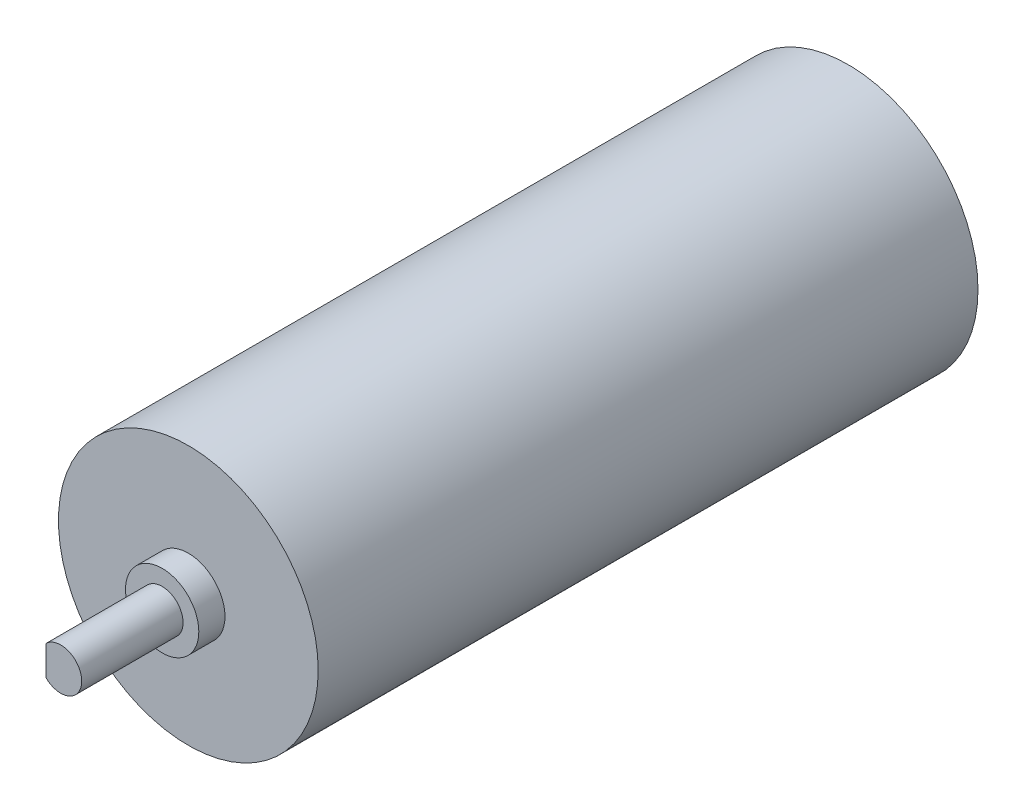
from build123d import *

# Parameters (mm, degrees)
SKETCH_1_R      = 12.4
EXTRUDE_1_DEPTH = 63
SKETCH_2_R      = 3.5
EXTRUDE_2_DEPTH = 2.5
EXTRUDE_3_DEPTH = 9.68


with BuildPart() as part:
    # 草图1 → 凸台-拉伸1 (new body)
    with BuildSketch(Plane.XY):
        Circle(SKETCH_1_R)
    extrude(amount=EXTRUDE_1_DEPTH)

    # 草图2 → 凸台-拉伸2 (add)
    with BuildSketch(Plane.XY.offset(63)):
        Circle(SKETCH_2_R)
    extrude(amount=EXTRUDE_2_DEPTH)

    # 草图3 → 凸台-拉伸3 (add)
    with BuildSketch(Plane.XY.offset(65.5)):
        with BuildLine():
            Line((-1.41, 1.418414608), (-1.41, -1.418414608))
            ThreePointArc((-1.41, -1.418414608), (2, 0), (-1.41, 1.418414608))
        make_face()
    extrude(amount=EXTRUDE_3_DEPTH)


solid = part.part
